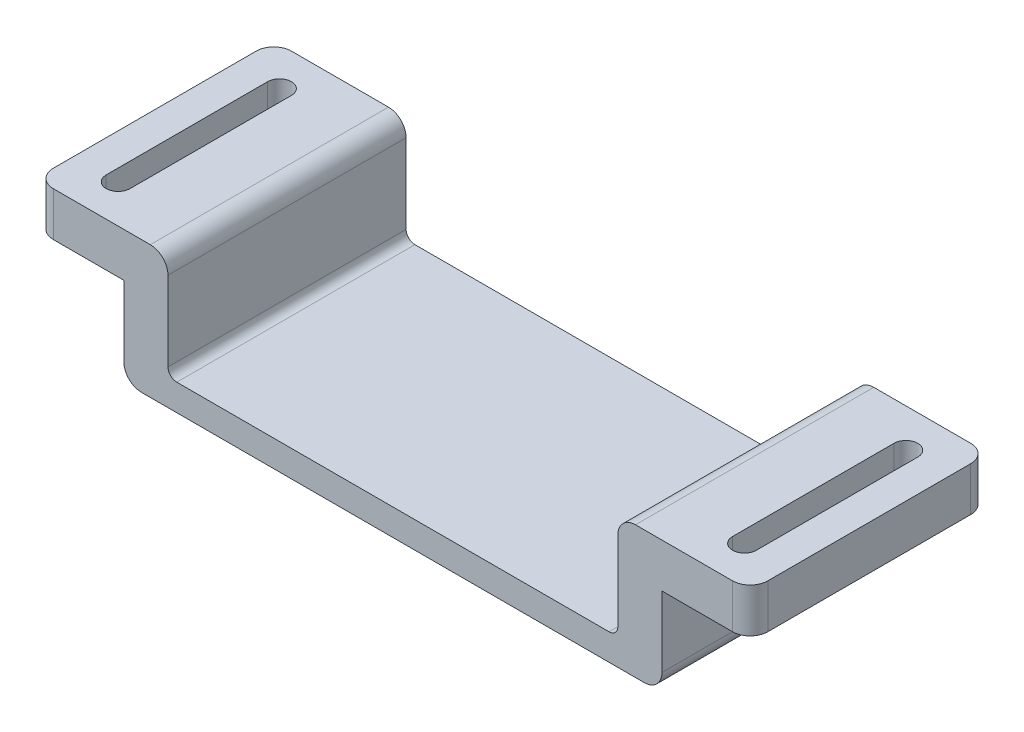
from build123d import *

# Parameters (mm, degrees)
SKETCH1_W           = 61
SKETCH1_H           = 27
BOSS_EXTRUDE1_DEPTH = 3
SKETCH2_W           = 5
SKETCH2_H           = 27
BOSS_EXTRUDE2_DEPTH = 7
SKETCH3_W           = 15
SKETCH3_H           = 27
BOSS_EXTRUDE3_DEPTH = 5
CUT_EXTRUDE1_DEPTH  = 77.615925238
FILLET1_R           = 2
FILLET2_R           = 2
FILLET3_R           = 1


with BuildPart() as part:
    # Sketch1 → Boss-Extrude1 (new body)
    with BuildSketch(Plane(origin=(0, 0, 0), x_dir=(1, 0, 0), z_dir=(0, 1, 0))):
        with Locations((30.5, 13.5)):
            Rectangle(SKETCH1_W, SKETCH1_H)
    extrude(amount=BOSS_EXTRUDE1_DEPTH)

    # Sketch2 → Boss-Extrude2 (add)
    with BuildSketch(Plane(origin=(0, 3, 0), x_dir=(1, 0, 0), z_dir=(0, 1, 0))):
        with Locations((2.5, 13.5)):
            Rectangle(SKETCH2_W, SKETCH2_H)
        with Locations((58.5, 13.5)):
            Rectangle(SKETCH2_W, SKETCH2_H)
    extrude(amount=BOSS_EXTRUDE2_DEPTH)

    # Sketch3 → Boss-Extrude3 (add)
    with BuildSketch(Plane(origin=(0, 10, 0), x_dir=(1, 0, 0), z_dir=(0, 1, 0))):
        with Locations((-2.5, 13.5)):
            Rectangle(SKETCH3_W, SKETCH3_H)
        with Locations((63.5, 13.5)):
            Rectangle(SKETCH3_W, SKETCH3_H)
    extrude(amount=BOSS_EXTRUDE3_DEPTH)

    # Sketch4 → Cut-Extrude1 (cut, through all)
    with BuildSketch(Plane.XZ.offset(-10)):
        with BuildLine():
            Line((-3.65, -4.35), (-3.65, -22.65))
            ThreePointArc((-3.65, -22.65), (-5, -24), (-6.35, -22.65))
            Line((-6.35, -22.65), (-6.35, -4.35))
            ThreePointArc((-6.35, -4.35), (-5, -3), (-3.65, -4.35))
        make_face()
        with BuildLine():
            Line((67.35, -4.35), (67.35, -22.65))
            ThreePointArc((67.35, -22.65), (66, -24), (64.65, -22.65))
            Line((64.65, -22.65), (64.65, -4.35))
            ThreePointArc((64.65, -4.35), (66, -3), (67.35, -4.35))
        make_face()
    extrude(amount=-CUT_EXTRUDE1_DEPTH, mode=Mode.SUBTRACT)

    # Fillet1
    fillet1_edges = [part.edges().sort_by_distance(p)[0] for p in [
        (-10, 12.5, -27),
        (-10, 12.5, 0),
        (71, 12.5, 0),
        (71, 12.5, -27),
    ]]
    fillet(fillet1_edges, radius=FILLET1_R)

    # Fillet2
    fillet2_edges = [part.edges().sort_by_distance(p)[0] for p in [
        (5, 15, -13.5),
        (56, 15, -13.5),
        (61, 0, -13.5),
        (0, 0, -13.5),
    ]]
    fillet(fillet2_edges, radius=FILLET2_R)

    # Fillet3
    fillet3_edges = [part.edges().sort_by_distance(p)[0] for p in [
        (5, 3, -13.5),
        (56, 3, -13.5),
    ]]
    fillet(fillet3_edges, radius=FILLET3_R)


solid = part.part
